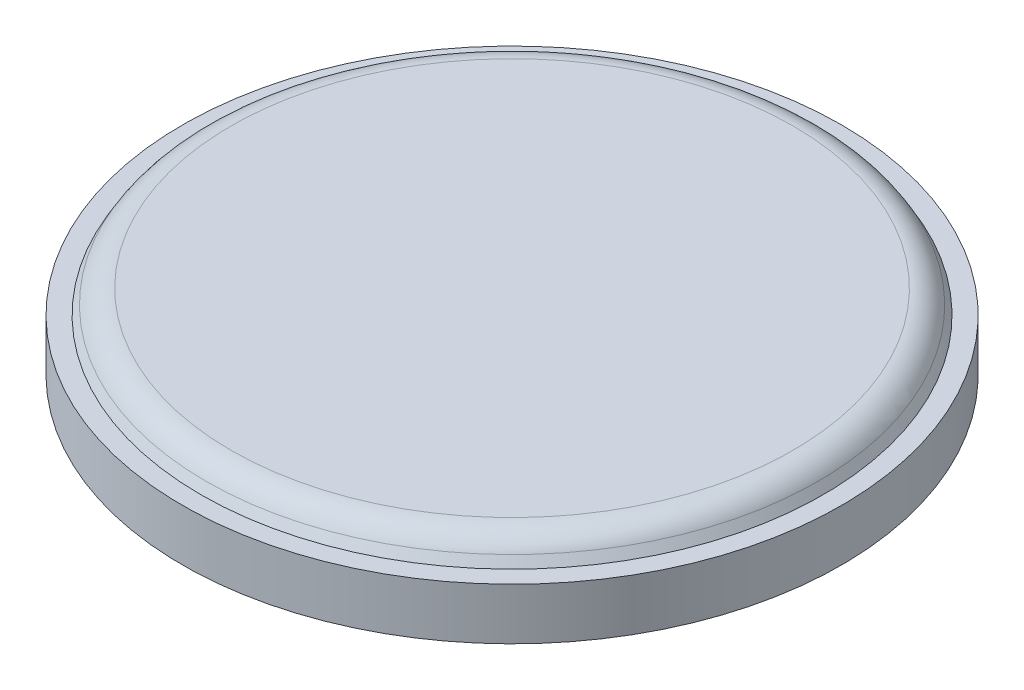
from build123d import *

# Parameters (mm, degrees)
SHELL1_T           = -1
SKETCH3_R          = 4
CUT_EXTRUDE3_DEPTH = 2
CIRPATTERN1_COUNT  = 30


with BuildPart() as part:
    # Sketch1 → Revolve1 (revolve)
    with BuildSketch(Plane.YZ, mode=Mode.PRIVATE) as revolve1_sk:
        with BuildLine():
            Line((0, 0), (13.02, 0))
            Line((13.02, 0), (13.02, 48.76))
            ThreePointArc((13.02, 48.76), (12.350127019, 51.26), (10.52, 53.090127019))
            Line((10.52, 53.090127019), (8.96, 53.990793439))
            Line((8.96, 53.990793439), (8.96, 57.190793439))
            Line((8.96, 57.190793439), (0, 57.190793439))
            Line((0, 57.190793439), (0, 0))
        make_face()
    revolve(revolve1_sk.sketch.rotate(Axis((0, -88.855588477, 0), (0, 1, 0)), 180), axis=Axis((0, -88.855588477, 0), (0, 1, 0)))

    # Shell1
    shell1_openings = [part.faces().sort_by_distance(p)[0] for p in [
        (0, 0, 0),
    ]]
    offset(amount=SHELL1_T, openings=shell1_openings, kind=Kind.INTERSECTION)

    # Sketch2 → Revolve2 (revolve)
    with BuildSketch(Plane.YZ, mode=Mode.PRIVATE) as revolve2_sk:
        Polygon((4.96, 53.41344317), (7.96, 53.41344317), (7.96, 55.41344317), (4.131572875, 55.41344317), (0.96, 52.241870294), (0.96, 30.585016045), (5.191572875, 26.35344317), (12.02, 26.35344317), (12.02, 28.35344317), (6.02, 28.35344317), (2.96, 31.41344317), (2.96, 51.41344317), align=None)
    revolve(revolve2_sk.sketch.rotate(Axis((0, -18.870621066, 0), (0, 1, 0)), 180), axis=Axis((0, -18.870621066, 0), (0, 1, 0)))

    # Sketch3 → Cut-Extrude3 (cut)
    with BuildSketch(Plane(origin=(0, 0.96, 0), x_dir=(-1, 0, 0), z_dir=(0, 1, 0))):
        with Locations(Location((41.38, 0, 0), (0, 0, 90))):
            Circle(SKETCH3_R)
    cut_extrude3 = extrude(amount=CUT_EXTRUDE3_DEPTH, mode=Mode.SUBTRACT)

    # CirPattern1: Cut-Extrude3 ×30 about axis
    cirpattern1_axis = Axis((0, 0, 0), (0, 1, 0))
    for i in range(1, CIRPATTERN1_COUNT):
        add(cut_extrude3.rotate(cirpattern1_axis, i * 360 / CIRPATTERN1_COUNT), mode=Mode.SUBTRACT)


solid = part.part
